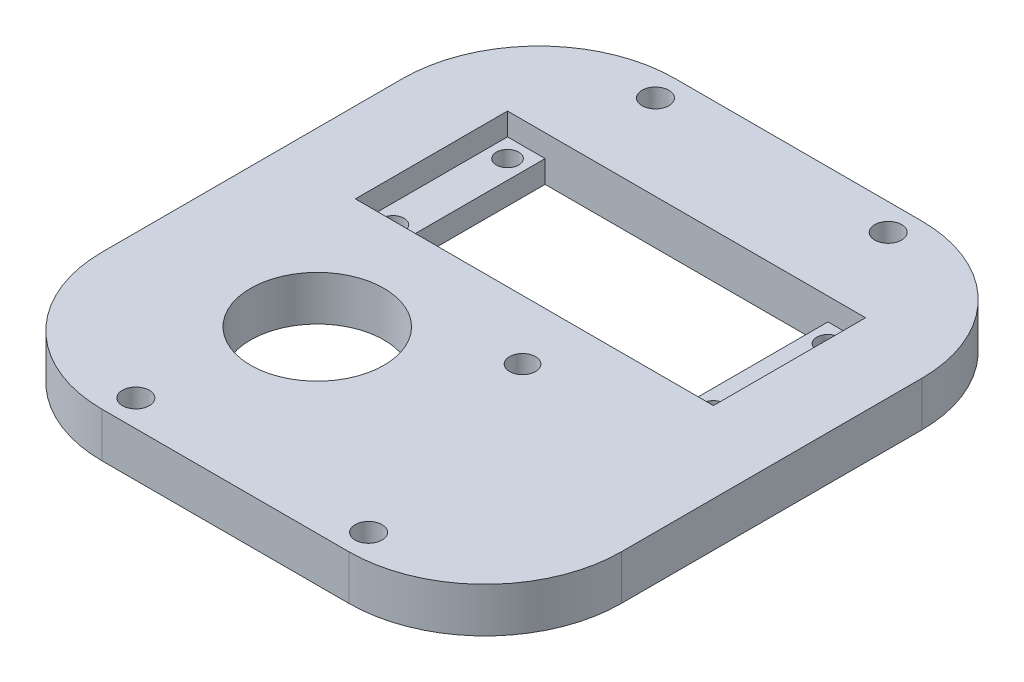
from build123d import *

# Parameters (mm, degrees)
SKETCH1_R           = 1.45
SKETCH1_R_2         = 2
BOSS_EXTRUDE1_DEPTH = 5
SKETCH4_R           = 1.5
CUT_EXTRUDE2_DEPTH  = 5
SKETCH5_4_R         = 7.45
CUT_EXTRUDE6_DEPTH  = 5
SKETCH6_W           = 31.6
SKETCH6_H           = 17
SKETCH6_R           = 1.25
CUT_EXTRUDE8_DEPTH  = 5
SKETCH6_4_W         = 4.2
SKETCH6_4_H         = 4.2
SKETCH6_4_R         = 1.25
SKETCH6_4_H_2       = 8.6
CUT_EXTRUDE9_DEPTH  = 2.5


with BuildPart() as part:
    # Sketch1 → Boss-Extrude1 (new body)
    with BuildSketch(Plane(origin=(0, 0, 0), x_dir=(1, 0, 0), z_dir=(0, 1, 0))):
        with BuildLine():
            Line((-29, -28.777515286), (-29, 4.777515286))
            ThreePointArc((-29, 4.777515286), (-24.541437454, 15.541437454), (-13.777515286, 20))
            Line((-13.777515286, 20), (13.777515286, 20))
            ThreePointArc((13.777515286, 20), (24.541437454, 15.541437454), (29, 4.777515286))
            Line((29, 4.777515286), (29, -28.777515286))
            ThreePointArc((29, -28.777515286), (24.541437454, -39.541437454), (13.777515286, -44))
            Line((13.777515286, -44), (-13.777515286, -44))
            ThreePointArc((-13.777515286, -44), (-24.541437454, -39.541437454), (-29, -28.777515286))
        make_face()
        with Locations(Location((5.323230148, -16.145068002, 0), (0, 0, 270))):
            Circle(SKETCH1_R, mode=Mode.SUBTRACT)
        with Locations(Location((-9.753243024, -24, 0), (0, 0, 270))):
            Circle(SKETCH1_R_2, mode=Mode.SUBTRACT)
    extrude(amount=BOSS_EXTRUDE1_DEPTH)

    # Sketch4 → Cut-Extrude2 (cut)
    with BuildSketch(Plane(origin=(0, 5, 0), x_dir=(1, 0, 0), z_dir=(0, 1, 0))):
        with Locations(Location((13, 17.024816986, 0), (0, 0, 270))):
            Circle(SKETCH4_R)
        with Locations(Location((-13, 17.024816986, 0), (0, 0, 270))):
            Circle(SKETCH4_R)
        with Locations(Location((-13, -41.024816986, 0), (0, 0, 270))):
            Circle(SKETCH4_R)
        with Locations(Location((13, -41.024816986, 0), (0, 0, 270))):
            Circle(SKETCH4_R)
    extrude(amount=-CUT_EXTRUDE2_DEPTH, mode=Mode.SUBTRACT)

    # Sketch5<4> → Cut-Extrude6 (cut)
    with BuildSketch(Plane(origin=(0, 0, 0), x_dir=(1, 0, 0), z_dir=(0, 1, 0))):
        with Locations(Location((-9.753243024, -24, 0), (0, 0, 270))):
            Circle(SKETCH5_4_R)
    extrude(amount=CUT_EXTRUDE6_DEPTH, mode=Mode.SUBTRACT)

    # Sketch6 → Cut-Extrude8 (cut)
    with BuildSketch(Plane(origin=(0, 5, 0), x_dir=(1, 0, 0), z_dir=(0, 1, 0))):
        with Locations((0, -1)):
            Rectangle(SKETCH6_W, SKETCH6_H)
        with Locations(Location((-17.9, 5.4, 0), (0, 0, 270))):
            Circle(SKETCH6_R)
        with Locations(Location((-17.9, -7.4, 0), (0, 0, 270))):
            Circle(SKETCH6_R)
        with Locations(Location((17.9, 5.4, 0), (0, 0, 270))):
            Circle(SKETCH6_R)
        with Locations(Location((17.9, -7.4, 0), (0, 0, 270))):
            Circle(SKETCH6_R)
    extrude(amount=-CUT_EXTRUDE8_DEPTH, mode=Mode.SUBTRACT)

    # Sketch6<4> → Cut-Extrude9 (cut)
    # profile 1 of 6: a face of its own
    with BuildSketch(Plane(origin=(0, 5, 0), x_dir=(1, 0, 0), z_dir=(0, 1, 0))):
        with Locations((-17.9, 5.4)):
            Rectangle(SKETCH6_4_W, SKETCH6_4_H)
        with Locations(Location((-17.9, 5.4, 0), (0, 0, 270))):
            Circle(SKETCH6_4_R, mode=Mode.SUBTRACT)
    # profile 2 of 6: a face of its own
    with BuildSketch(Plane(origin=(0, 5, 0), x_dir=(1, 0, 0), z_dir=(0, 1, 0))):
        with Locations((17.9, 5.4)):
            Rectangle(SKETCH6_4_W, SKETCH6_4_H)
        with Locations(Location((17.9, 5.4, 0), (0, 0, 270))):
            Circle(SKETCH6_4_R, mode=Mode.SUBTRACT)
    # profile 3 of 6: a face of its own
    with BuildSketch(Plane(origin=(0, 5, 0), x_dir=(1, 0, 0), z_dir=(0, 1, 0))):
        with Locations((-17.9, -7.4)):
            Rectangle(SKETCH6_4_W, SKETCH6_4_H)
        with Locations(Location((-17.9, -7.4, 0), (0, 0, 270))):
            Circle(SKETCH6_4_R, mode=Mode.SUBTRACT)
    # profile 4 of 6: a face of its own
    with BuildSketch(Plane(origin=(0, 5, 0), x_dir=(1, 0, 0), z_dir=(0, 1, 0))):
        with Locations((17.9, -7.4)):
            Rectangle(SKETCH6_4_W, SKETCH6_4_H)
        with Locations(Location((17.9, -7.4, 0), (0, 0, 270))):
            Circle(SKETCH6_4_R, mode=Mode.SUBTRACT)
    # profile 5 of 6: a face of its own
    with BuildSketch(Plane(origin=(0, 5, 0), x_dir=(1, 0, 0), z_dir=(0, 1, 0))):
        with Locations((-17.9, -1)):
            Rectangle(SKETCH6_4_W, SKETCH6_4_H_2)
    # profile 6 of 6: a face of its own
    with BuildSketch(Plane(origin=(0, 5, 0), x_dir=(1, 0, 0), z_dir=(0, 1, 0))):
        with Locations((17.9, -1)):
            Rectangle(SKETCH6_4_W, SKETCH6_4_H_2)
    extrude(amount=-CUT_EXTRUDE9_DEPTH, mode=Mode.SUBTRACT)


solid = part.part
